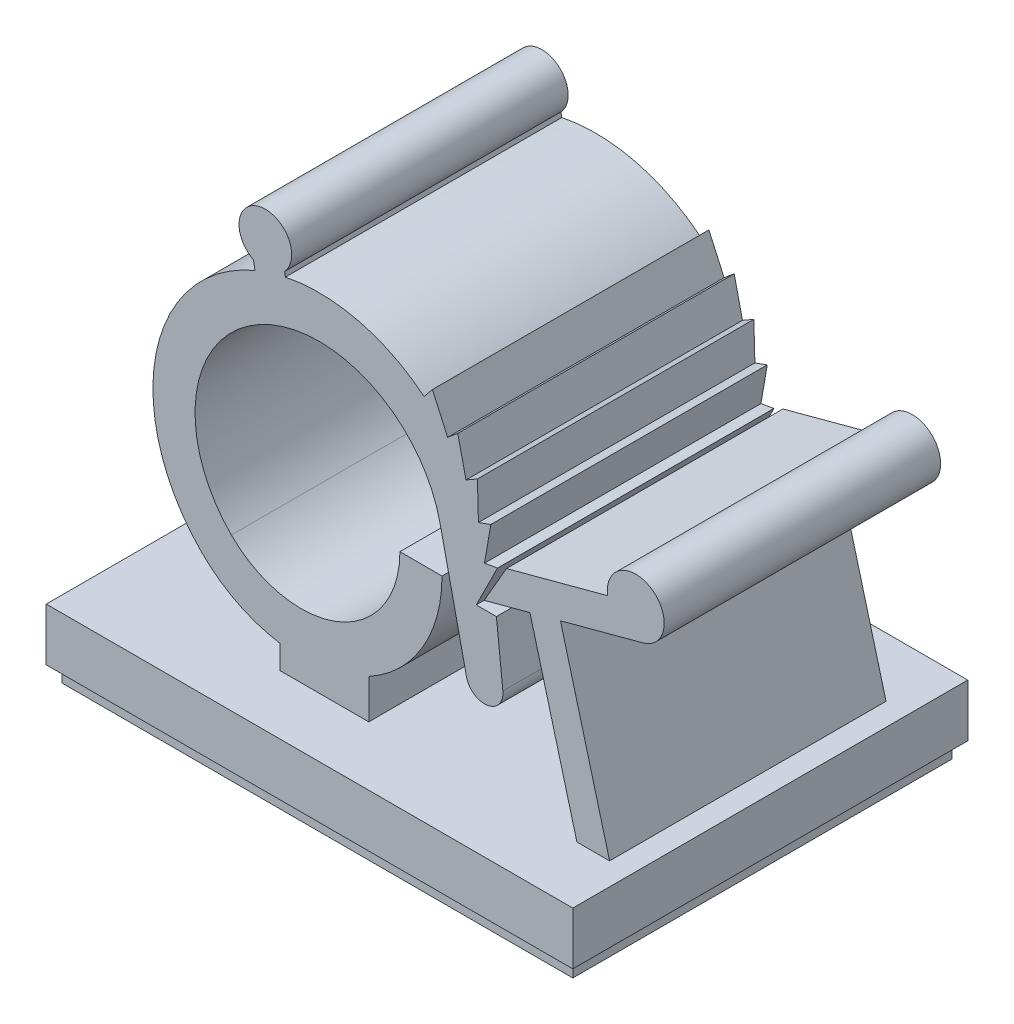
from build123d import *

# Parameters (mm, degrees)
BOSS_EXTRUDE1_START = 0.762
SKETCH1_W           = 25.4
SKETCH1_H           = 19.05
BOSS_EXTRUDE1_DEPTH = 2.54
SKETCH2_W           = 24.638
SKETCH2_H           = 18.288
BOSS_EXTRUDE2_DEPTH = 0.762
BOSS_EXTRUDE3_DEPTH = 6.6675
BOSS_EXTRUDE4_DEPTH = 6.6675


with BuildPart() as part:
    # Sketch1 → Boss-Extrude1 (new body)
    with BuildSketch(Plane(origin=(0, 0, 0), x_dir=(1, 0, 0), z_dir=(0, 1, 0)).offset(BOSS_EXTRUDE1_START)):
        Rectangle(SKETCH1_W, SKETCH1_H)
    extrude(amount=BOSS_EXTRUDE1_DEPTH)

    # Sketch2 → Boss-Extrude2 (add)
    with BuildSketch(Plane.XZ.offset(-0.762)):
        Rectangle(SKETCH2_W, SKETCH2_H)
    extrude(amount=BOSS_EXTRUDE2_DEPTH)

    # Sketch4 → Boss-Extrude3 (add, symmetric)
    with BuildSketch(Plane.XY):
        with BuildLine():
            Line((1.501676205, 11.161675617), (3.533676205, 11.161675617))
            ThreePointArc((3.533676205, 11.161675617), (2.583870274, 7.696883923), (0, 5.200781521))
            Line((0, 5.200781521), (0, 3.302))
            Line((0, 3.302), (-4.28625, 3.302))
            Line((-4.28625, 3.302), (-4.28625, 4.445))
            ThreePointArc((-4.28625, 4.445), (-6.328557556, 5.099148106), (-8.06526082, 6.357238593))
            ThreePointArc((-8.06526082, 6.357238593), (-10.260478652, 13.572969866), (-5.489821493, 19.414766629))
            Line((-5.489821493, 19.414766629), (-5.561648074, 19.822115412))
            ThreePointArc((-5.561648074, 19.822115412), (-5.2081843, 22.205705846), (-4.060801058, 20.086755234))
            Line((-4.060801058, 20.086755234), (-4.022330337, 19.86857693))
            ThreePointArc((-4.022330337, 19.86857693), (-0.491642159, 19.803987548), (2.668342576, 18.227780941))
            Line((2.668342576, 18.227780941), (3.070034491, 18.719582328))
            Line((3.070034491, 18.719582328), (3.805281528, 17.090841988))
            Line((3.805281528, 17.090841988), (4.291759283, 17.499045293))
            Line((4.291759283, 17.499045293), (4.690845695, 15.752574138))
            Line((4.690845695, 15.752574138), (5.241166338, 16.07030191))
            Line((5.241166338, 16.07030191), (5.289319806, 14.273673387))
            Line((5.289319806, 14.273673387), (5.887168028, 14.491272344))
            Line((5.887168028, 14.491272344), (5.581577343, 12.720829512))
            Line((5.581577343, 12.720829512), (6.209142893, 12.831486251))
            Line((6.209142893, 12.831486251), (5.184676205, 10.780675617))
            Line((5.184676205, 10.780675617), (6.157416197, 10.780675617))
            Line((6.157416197, 10.780675617), (6.467196887, 7.825354003))
            ThreePointArc((6.467196887, 7.825354003), (5.725539877, 6.855170599), (4.714991862, 7.540811663))
            Line((4.714991862, 7.540811663), (3.439133103, 13.313172794))
            ThreePointArc((3.439133103, 13.313172794), (-5.274572471, 17.26630154), (-6.628419841, 7.794079572))
            ThreePointArc((-6.628419841, 7.794079572), (-1.438293949, 6.761699344), (1.501676205, 11.161675617))
        make_face()
    extrude(amount=BOSS_EXTRUDE3_DEPTH, both=True)

    # Sketch3 → Boss-Extrude4 (add, symmetric)
    with BuildSketch(Plane.XY):
        with BuildLine():
            Line((10.038311288, 3.302), (7.773782644, 11.753335954))
            Line((7.773782644, 11.753335954), (5.565676205, 11.161675617))
            Line((5.565676205, 11.161675617), (6.643306939, 13.028186801))
            Line((6.643306939, 13.028186801), (11.521611933, 14.335324685))
            ThreePointArc((11.521611933, 14.335324685), (13.628547334, 15.688756773), (13.232712451, 13.216051788))
            Line((13.232712451, 13.216051788), (9.245853603, 12.147776179))
            Line((9.245853603, 12.147776179), (11.616072187, 3.302))
            Line((11.616072187, 3.302), (10.038311288, 3.302))
        make_face()
    extrude(amount=BOSS_EXTRUDE4_DEPTH, both=True)


solid = part.part
